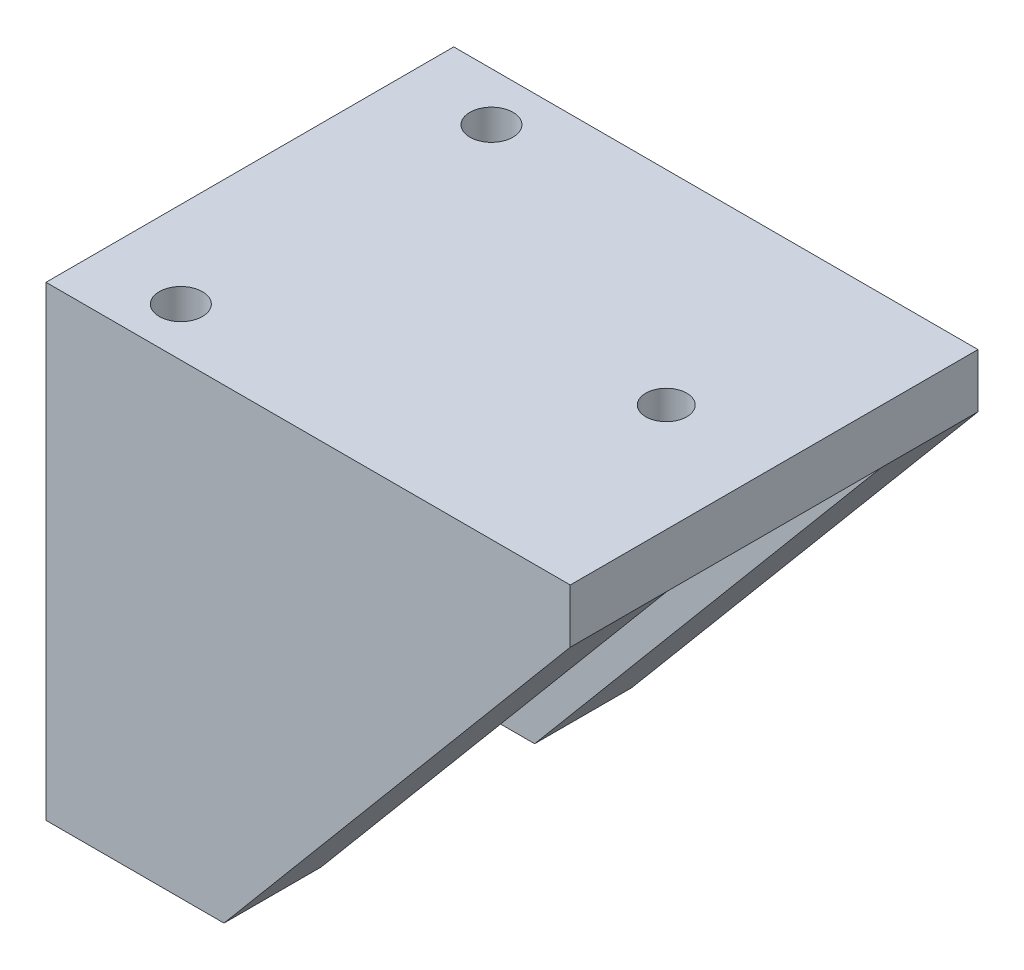
from build123d import *

# Parameters (mm, degrees)
EXTRUDE_1_DEPTH     = 19.8
EXTRUDE_1_2_DEPTH   = 19.8
SKETCH_2_W          = 1
SKETCH_2_H          = 0.8
CUT_EXTRUDE_1_DEPTH = 8
EXTRUDE_2_DEPTH     = 9
EXTRUDE_3_DEPTH     = 9
CUT_EXTRUDE_2_REACH = 73.167
SKETCH_5_R          = 1.9
CUT_EXTRUDE_5_REACH = 68.298
SKETCH_8_W          = 19.8
SKETCH_8_H          = 8.5
SKETCH_9_R          = 2.15
EXTRUDE_4_DEPTH     = 5
CUT_EXTRUDE_6_REACH = 73.167
SKETCH_10_R         = 2


with BuildPart() as part:
    # 草圖1 → 填料-伸長1 (new body)
    with BuildSketch(Plane.XY):
        Polygon((-40.673096552, 29.7), (-40.673096552, 2.8), (-48.673096552, 2.8), (-48.673096552, 34.7), (-41.673096552, 34.7), (-0.073096552, 34.7), (-0.073096552, 29.7), align=None)
    extrude(amount=EXTRUDE_1_DEPTH)



with BuildPart() as body_2:
    # 草圖1 → Extrude 1 2 (new body)
    with BuildSketch(Plane.XY):
        Polygon((-48.673096552, -8.5), (-40.673096552, -8.5), (-40.673096552, -3.2), (-40.673096552, 0), (-48.673096552, 0), align=None)
    extrude(amount=EXTRUDE_1_2_DEPTH)

    # 草圖2 → 除料-伸長1 (cut)
    with BuildSketch(Plane.ZY.offset(48.673096552)):
        with Locations((9.9, -0.4)):
            Rectangle(SKETCH_2_W, SKETCH_2_H)
    extrude(amount=-CUT_EXTRUDE_1_DEPTH, mode=Mode.SUBTRACT)


with BuildPart() as part_1:
    add(part.part)

    add(body_2.part)  # 填料-伸長2 merges body 2
    # 草圖3 → 填料-伸長2 (add)
    with BuildSketch(Plane.XY.offset(19.8)):
        Polygon((-48.673096552, -8.5), (-32.173096552, -8.5), (-0.073096552, 29.7), (-0.073096552, 34.7), (-48.673096552, 34.7), align=None)
    extrude(amount=EXTRUDE_2_DEPTH)

    # 草圖4 → 填料-伸長3 (add)
    with BuildSketch(Plane(origin=(0, 0, 0), x_dir=(-1, 0, 0), z_dir=(0, 0, -1))):
        Polygon((48.673096552, -8.5), (48.673096552, 34.7), (0.073096552, 34.7), (0.073096552, 29.7), (32.173096552, -8.5), align=None)
    extrude(amount=EXTRUDE_3_DEPTH)

    # 草圖5 → 除料-伸長2 (cut, up to next)
    with BuildSketch(Plane(origin=(0, 34.7, 0), x_dir=(1, 0, 0), z_dir=(0, 1, 0)), mode=Mode.PRIVATE) as cut_extrude_2_sk1:
        with Locations(Location((-10.073096552, -9.9, 0), (0, 0, 270))):
            Circle(SKETCH_5_R)
    cut_extrude_2_tool1 = extrude(cut_extrude_2_sk1.sketch, amount=-CUT_EXTRUDE_2_REACH, mode=Mode.PRIVATE) & part_1.part
    add(cut_extrude_2_tool1.solids().sort_by_distance((-10.073097, 34.7, 9.9))[0], mode=Mode.SUBTRACT)

    # 除料-伸長5: up to this plane
    cut_extrude_5_end = Plane(origin=(-0.073096552, 29.7, -9), z_dir=(-0.765586407498208, 0.6433330806464003, 0))
    # 草圖8 → 除料-伸長5 (cut, up to the surface)
    with BuildSketch(Plane.ZY.offset(48.673096552), mode=Mode.PRIVATE) as cut_extrude_5_sk1:
        with Locations((9.9, -4.25)):
            Rectangle(SKETCH_8_W, SKETCH_8_H)
    cut_extrude_5_tool1 = split(extrude(cut_extrude_5_sk1.sketch, amount=-CUT_EXTRUDE_5_REACH, mode=Mode.PRIVATE), bisect_by=cut_extrude_5_end, keep=Keep.BOTH, mode=Mode.PRIVATE)
    add(cut_extrude_5_tool1.solids().sort_by_distance((-48.673097, -4.25, 9.9))[0], mode=Mode.SUBTRACT)

    # 草圖9 → 填料-伸長4 (add)
    with BuildSketch(Plane.XZ.offset(-2.8)):
        with Locations(Location((-45.273096552, 14.9, 0), (0, 0, 90))):
            Circle(SKETCH_9_R)
        with Locations(Location((-45.273096552, 4.9, 0), (0, 0, 90))):
            Circle(SKETCH_9_R)
    extrude(amount=EXTRUDE_4_DEPTH)

    # 草圖10 → 除料-伸長6 (cut, up to next)
    with BuildSketch(Plane(origin=(0, -8.5, 0), x_dir=(-1, 0, 0), z_dir=(0, -1, 0)), mode=Mode.PRIVATE) as cut_extrude_6_sk1:
        with Locations(Location((40.673096552, -24.3, 0), (0, 0, 90))):
            Circle(SKETCH_10_R)
    cut_extrude_6_tool1 = extrude(cut_extrude_6_sk1.sketch, amount=-CUT_EXTRUDE_6_REACH, mode=Mode.PRIVATE) & part_1.part
    # 草圖10 → 除料-伸長6 (cut, up to next)
    with BuildSketch(Plane(origin=(0, -8.5, 0), x_dir=(-1, 0, 0), z_dir=(0, -1, 0)), mode=Mode.PRIVATE) as cut_extrude_6_sk2:
        with Locations(Location((40.673096552, 4.495764624, 0), (0, 0, 90))):
            Circle(SKETCH_10_R)
    cut_extrude_6_tool2 = extrude(cut_extrude_6_sk2.sketch, amount=-CUT_EXTRUDE_6_REACH, mode=Mode.PRIVATE) & part_1.part
    add(cut_extrude_6_tool1.solids().sort_by_distance((-40.673097, -8.5, 24.3))[0], mode=Mode.SUBTRACT)
    add(cut_extrude_6_tool2.solids().sort_by_distance((-40.673097, -8.5, -4.495765))[0], mode=Mode.SUBTRACT)


solid = part_1.part
